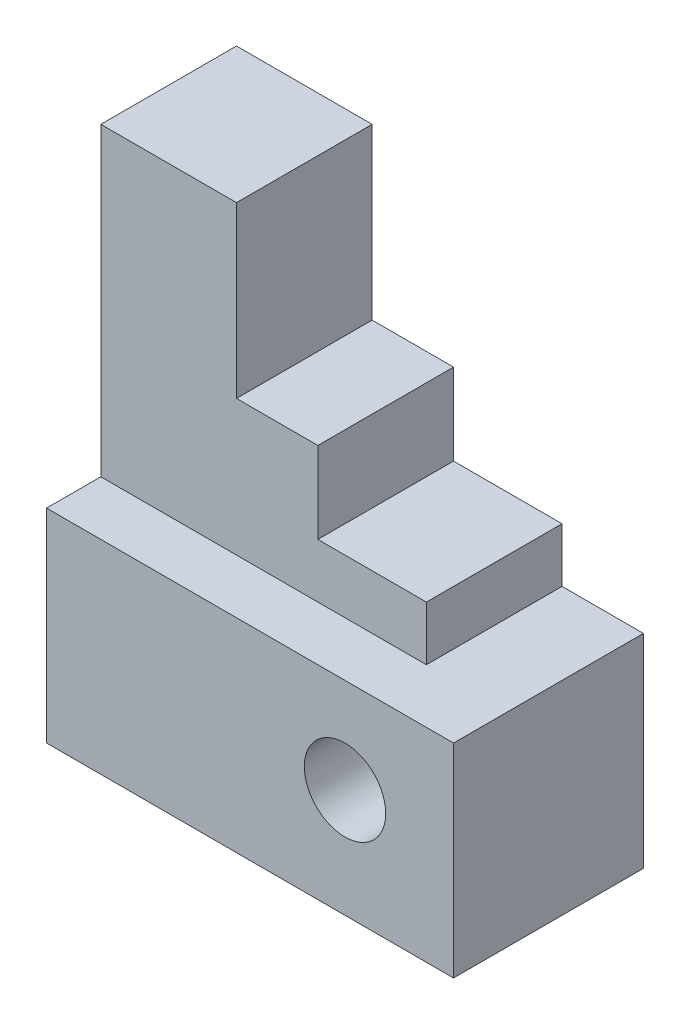
from build123d import *

# Parameters (mm, degrees)
SKETCH1_W               = 60
SKETCH1_H               = 75
BOSS_EXTRUDE1_DEPTH     = 14
CUT_EXTRUDE3_DEPTH      = 98.06183596
CUT_EXTRUDE3_DEPTH_BACK = 98.06183596
SKETCH2_W               = 40
SKETCH2_H               = 25
SKETCH2_W_2             = 12
SKETCH2_H_2             = 8
SKETCH2_R               = 6
SKETCH3_OUTSIDE_W       = 82.008
SKETCH3_OUTSIDE_H       = 50.008
SKETCH3_OUTSIDE_W_2     = 48
SKETCH3_OUTSIDE_H_2     = 20
CUT_EXTRUDE4_DEPTH      = 77.295478241


with BuildPart() as part:
    # Sketch1 → Boss-Extrude1 (new, symmetric)
    with BuildSketch(Plane.XY):
        with Locations((30, 37.5)):
            Rectangle(SKETCH1_W, SKETCH1_H)
    extrude(amount=BOSS_EXTRUDE1_DEPTH, both=True)

    # Sketch2 → Cut-Extrude3 (cut, two sides: drawn at the far end of the back side and taken through both)
    with BuildSketch(Plane.XY.offset(-CUT_EXTRUDE3_DEPTH_BACK)):
        with Locations((40, 62.5)):
            Rectangle(SKETCH2_W, SKETCH2_H)
        Polygon((60, 38), (60, 50), (32, 50), (32, 38), (48, 38), align=None)
        with Locations((54, 34)):
            Rectangle(SKETCH2_W_2, SKETCH2_H_2)
        with Locations((44, 16)):
            Circle(SKETCH2_R)
    extrude(amount=CUT_EXTRUDE3_DEPTH + CUT_EXTRUDE3_DEPTH_BACK, mode=Mode.SUBTRACT)

    # Sketch3 outside → Cut-Extrude4 (cut, through all)
    with BuildSketch(Plane(origin=(0, 30, 0), x_dir=(1, 0, 0), z_dir=(0, 1, 0))):
        with Locations((30, 0)):
            Rectangle(SKETCH3_OUTSIDE_W, SKETCH3_OUTSIDE_H)
        with Locations((24, 4)):
            Rectangle(SKETCH3_OUTSIDE_W_2, SKETCH3_OUTSIDE_H_2, mode=Mode.SUBTRACT)
    extrude(amount=CUT_EXTRUDE4_DEPTH, mode=Mode.SUBTRACT)


solid = part.part
